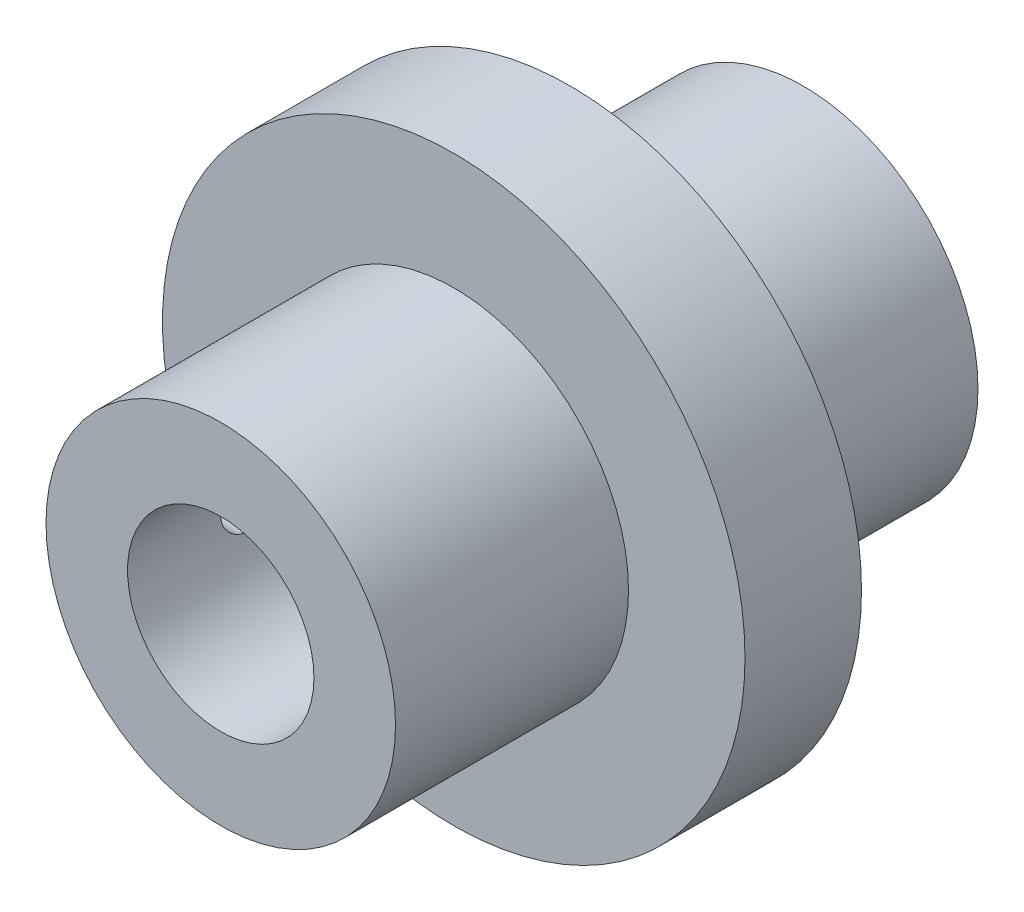
from build123d import *

# Parameters (mm, degrees)
SKETCH1_R           = 7.5
SKETCH1_R_2         = 4
BOSS_EXTRUDE1_DEPTH = 10
SKETCH3_R           = 12.5
SKETCH3_R_2         = 4
BOSS_EXTRUDE2_DEPTH = 5
SKETCH4_R           = 7.5
SKETCH4_R_2         = 4
BOSS_EXTRUDE3_DEPTH = 10
SKETCH5_R           = 1
CUT_EXTRUDE1_DEPTH  = 10


with BuildPart() as part:
    # Sketch1 → Boss-Extrude1 (new body)
    with BuildSketch(Plane.XY):
        Circle(SKETCH1_R)
        Circle(SKETCH1_R_2, mode=Mode.SUBTRACT)
    extrude(amount=BOSS_EXTRUDE1_DEPTH)

    # Sketch3 → Boss-Extrude2 (add)
    with BuildSketch(Plane.XY.offset(10)):
        Circle(SKETCH3_R)
        Circle(SKETCH3_R_2, mode=Mode.SUBTRACT)
    extrude(amount=BOSS_EXTRUDE2_DEPTH)

    # Sketch4 → Boss-Extrude3 (add)
    with BuildSketch(Plane.XY.offset(15)):
        Circle(SKETCH4_R)
        Circle(SKETCH4_R_2, mode=Mode.SUBTRACT)
    extrude(amount=BOSS_EXTRUDE3_DEPTH)

    # Sketch5 → Cut-Extrude1 (cut)
    with BuildSketch(Plane(origin=(0, 0, 0), x_dir=(0, 0, -1), z_dir=(1, 0, 0))):
        with Locations(Location((-20, 0, 0), (0, 0, 180))):
            Circle(SKETCH5_R)
    extrude(amount=-CUT_EXTRUDE1_DEPTH, mode=Mode.SUBTRACT)


solid = part.part
